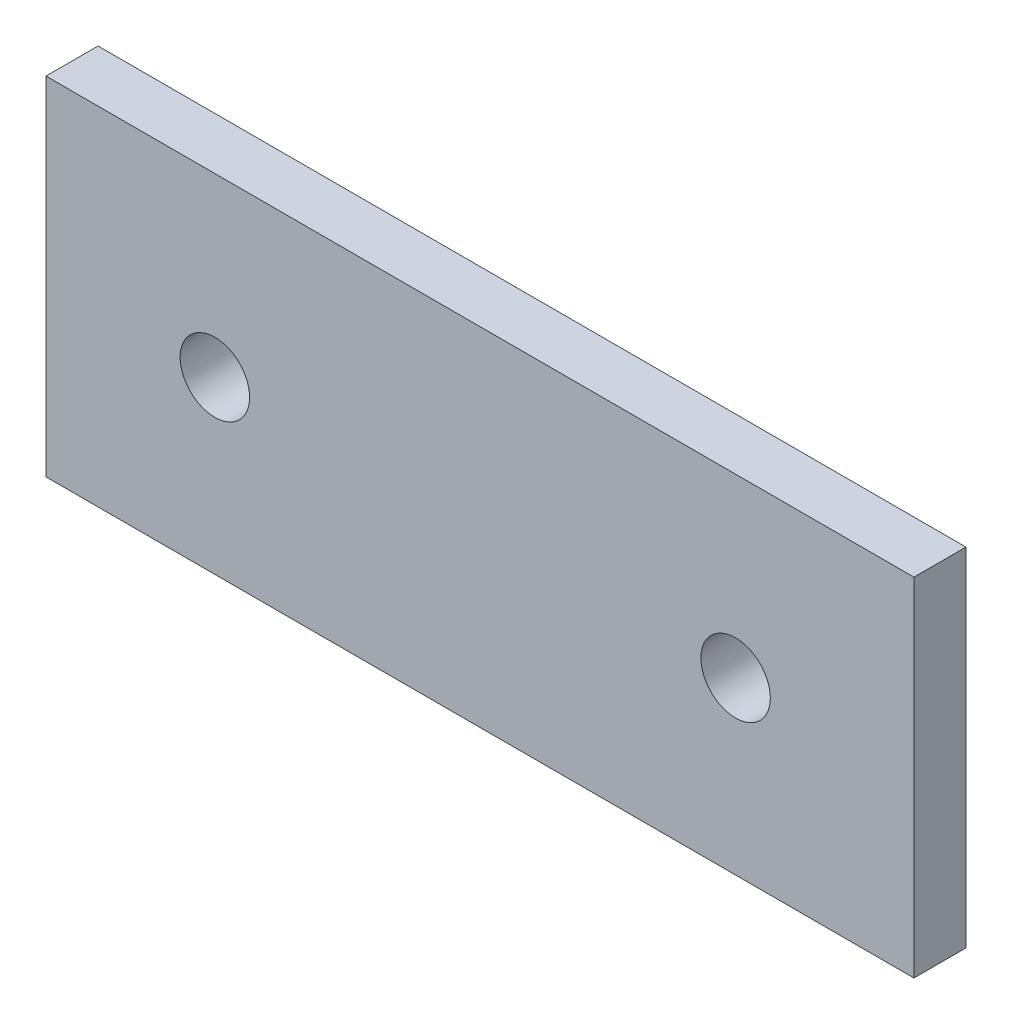
from build123d import *

# Parameters (mm, degrees)
SKETCH1_W           = 50
SKETCH1_H           = 20
SKETCH1_R           = 2
BOSS_EXTRUDE1_DEPTH = 3


with BuildPart() as part:
    # Sketch1 → Boss-Extrude1 (new body)
    with BuildSketch(Plane.XY):
        with Locations((-52.489082951, 0.165139096)):
            Rectangle(SKETCH1_W, SKETCH1_H)
        with Locations((-67.761571669, 0)):
            Circle(SKETCH1_R, mode=Mode.SUBTRACT)
        with Locations((-37.761571669, 0)):
            Circle(SKETCH1_R, mode=Mode.SUBTRACT)
    extrude(amount=BOSS_EXTRUDE1_DEPTH)


solid = part.part
